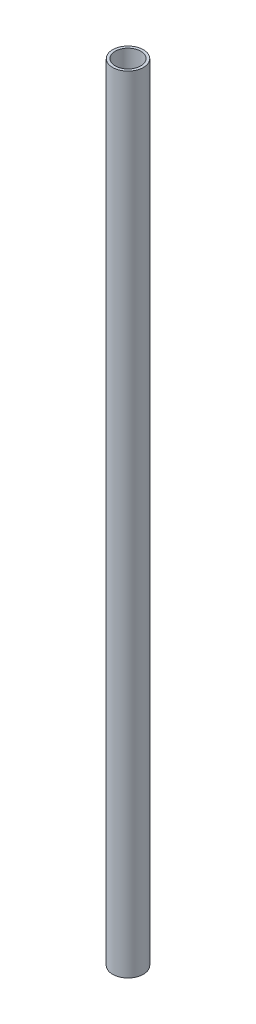
from build123d import *

# Parameters (mm, degrees)
SKETCH1_R           = 21.082
SKETCH1_R_2         = 17.526
BOSS_EXTRUDE1_DEPTH = 1075.69


with BuildPart() as part:
    # Sketch1 → Boss-Extrude1 (new body)
    with BuildSketch(Plane(origin=(0, 0, 0), x_dir=(1, 0, 0), z_dir=(0, 1, 0))):
        with Locations(Location((0, 0, 0), (0, 0, 270))):
            Circle(SKETCH1_R)
        with Locations(Location((0, 0, 0), (0, 0, 270))):
            Circle(SKETCH1_R_2, mode=Mode.SUBTRACT)
    extrude(amount=BOSS_EXTRUDE1_DEPTH)


solid = part.part
